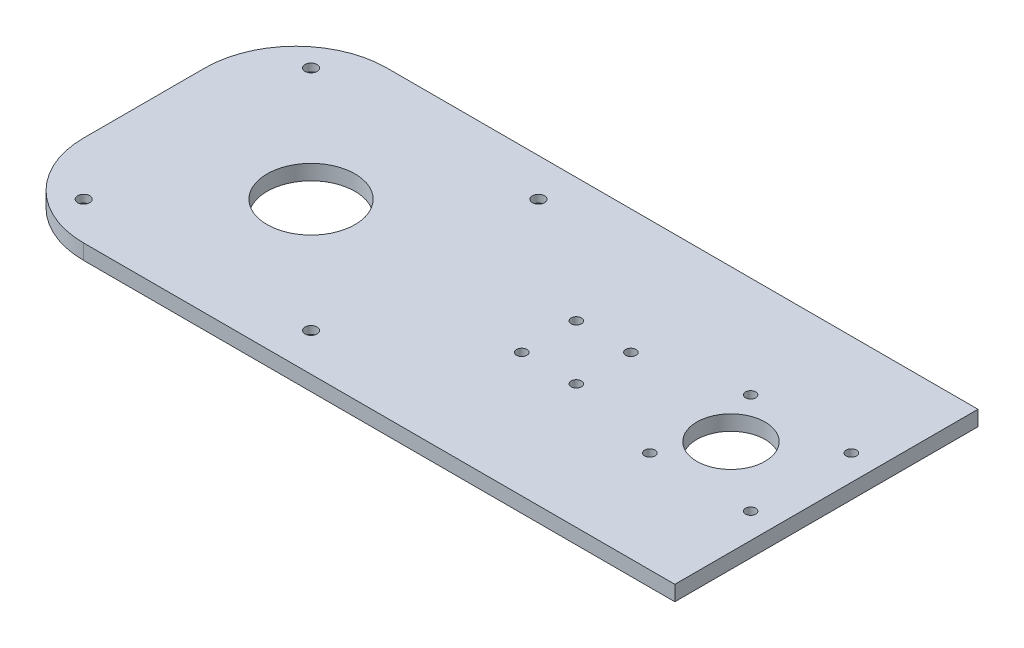
from build123d import *

# Parameters (mm, degrees)
SKETCH1_W             = 450
SKETCH1_H             = 200
EXTRUDE1_DEPTH        = 10
SKETCH2_R             = 29
SKETCH2_R_2           = 4
EXTRUDE2_DEPTH        = 10
M8_TAPPED_HOLE2_D     = 6.8
M8_TAPPED_HOLE2_DEPTH = 19.75
M8_TAPPED_HOLE2_TIP   = 2.042926105
SKETCH6_R             = 22.5
EXTRUDE3_DEPTH        = 10
SKETCH7_R             = 9
EXTRUDE4_DEPTH        = 5
LPATTERN1_COUNT       = 2
LPATTERN1_PITCH       = 150
LPATTERN1_COUNT_DIR2  = 2
LPATTERN1_PITCH_DIR2  = 150
M8_TAPPED_HOLE3_D     = 6.8
M8_TAPPED_HOLE3_DEPTH = 19.75
M8_TAPPED_HOLE3_TIP   = 2.042926105
FILLET1_R             = 60


with BuildPart() as part:
    # Sketch1 → Extrude1 (new body)
    with BuildSketch(Plane(origin=(0, 0, 0), x_dir=(1, 0, 0), z_dir=(0, 1, 0))):
        Rectangle(SKETCH1_W, SKETCH1_H)
    extrude(amount=EXTRUDE1_DEPTH)

    # Sketch2 → Extrude2 (cut)
    with BuildSketch(Plane(origin=(0, 10, 0), x_dir=(1, 0, 0), z_dir=(0, 1, 0))):
        with Locations(Location((-115, 0, 0), (0, 0, 270))):
            Circle(SKETCH2_R)
        with Locations(Location((-190, 75, 0), (0, 0, 270))):
            Circle(SKETCH2_R_2)
        with Locations(Location((-40, 75, 0), (0, 0, 90))):
            Circle(SKETCH2_R_2)
        with Locations(Location((-40, -75, 0), (0, 0, 270))):
            Circle(SKETCH2_R_2)
        with Locations(Location((-190, -75, 0), (0, 0, 90))):
            Circle(SKETCH2_R_2)
    extrude(amount=-EXTRUDE2_DEPTH, mode=Mode.SUBTRACT)

    # M8 Tapped Hole2
    with Locations(Plane(origin=(141.765981284, 10, -33.234018716), x_dir=(0, 0, 1), z_dir=(0, 1, 0))):
        with Locations((0, 0), (0, 66.468037432), (66.468037432, 0), (66.468037432, 66.468037432)):
            Hole(M8_TAPPED_HOLE2_D / 2, depth=M8_TAPPED_HOLE2_DEPTH)
            with Locations((0, 0, -(M8_TAPPED_HOLE2_DEPTH + M8_TAPPED_HOLE2_TIP / 2))):  # 118° drill point
                Cone(0, M8_TAPPED_HOLE2_D / 2, M8_TAPPED_HOLE2_TIP, mode=Mode.SUBTRACT)

    # Sketch6 → Extrude3 (cut)
    with BuildSketch(Plane(origin=(0, 10, 0), x_dir=(1, 0, 0), z_dir=(0, 1, 0))):
        with Locations(Location((162, 0, 0), (0, 0, 270))):
            Circle(SKETCH6_R)
    extrude(amount=-EXTRUDE3_DEPTH, mode=Mode.SUBTRACT)

    # Sketch7 → Extrude4 (cut)
    with BuildSketch(Plane.XZ):
        with Locations(Location((-190, 75, 0), (0, 0, 270))):
            Circle(SKETCH7_R)
    extrude4 = extrude(amount=-EXTRUDE4_DEPTH, mode=Mode.SUBTRACT)

    # LPattern1: Extrude4 2 × 2
    with Locations(*[(i * LPATTERN1_PITCH, 0, -j * LPATTERN1_PITCH_DIR2) for i in range(LPATTERN1_COUNT) for j in range(LPATTERN1_COUNT_DIR2) if (i, j) != (0, 0)]):
        add(extrude4, mode=Mode.SUBTRACT)

    # M8 Tapped Hole3
    with Locations(Plane(origin=(42, 10, -18), x_dir=(0, 0, 1), z_dir=(0, 1, 0))):
        with Locations((0, 0), (0, 36), (36, 0), (36, 36)):
            Hole(M8_TAPPED_HOLE3_D / 2, depth=M8_TAPPED_HOLE3_DEPTH)
            with Locations((0, 0, -(M8_TAPPED_HOLE3_DEPTH + M8_TAPPED_HOLE3_TIP / 2))):  # 118° drill point
                Cone(0, M8_TAPPED_HOLE3_D / 2, M8_TAPPED_HOLE3_TIP, mode=Mode.SUBTRACT)

    # Fillet1
    fillet1_edges = [part.edges().sort_by_distance(p)[0] for p in [
        (-225, 5, -100),
        (-225, 5, 100),
    ]]
    fillet(fillet1_edges, radius=FILLET1_R)


solid = part.part
